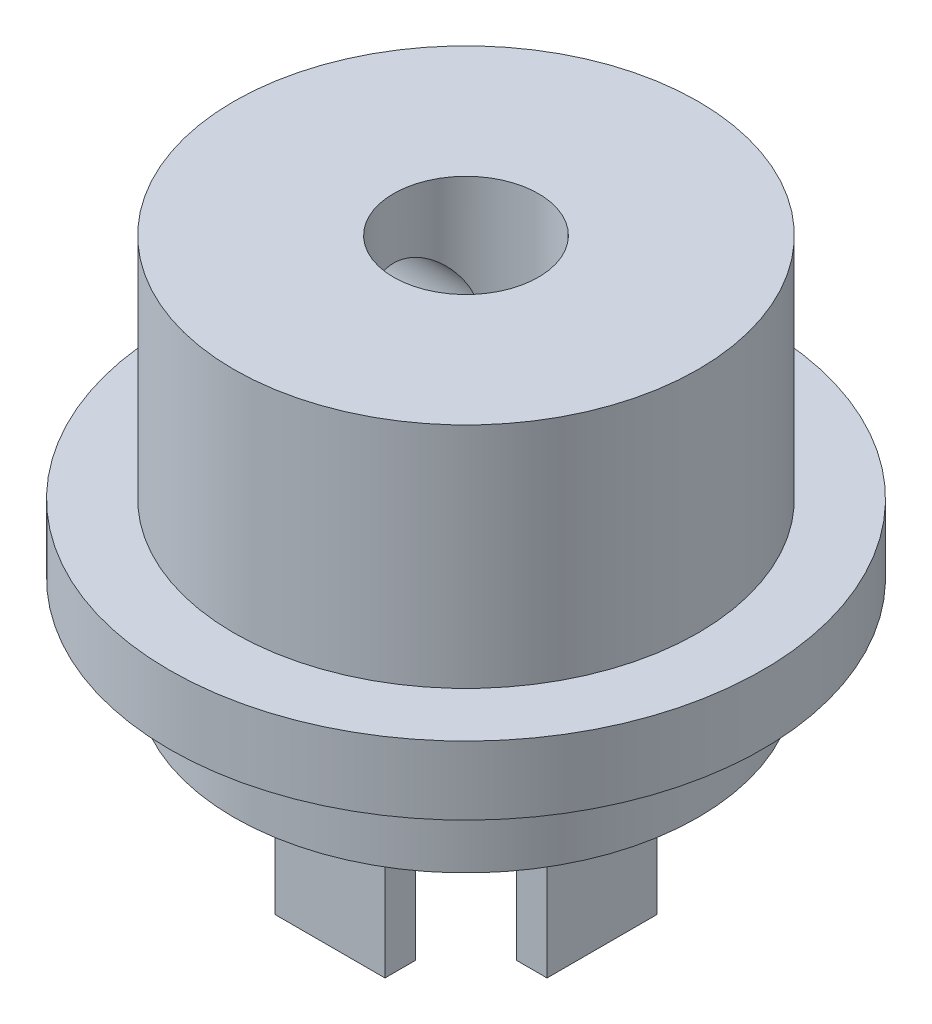
from build123d import *

# Parameters (mm, degrees)
BOSS_EXTRUDE1_DEPTH      = 10
BOSS_EXTRUDE1_DEPTH_BACK = 7
SKETCH1_R                = 10.175
SKETCH1_R_2              = 3.175
SKETCH1_3_R              = 13
SKETCH1_3_R_2            = 10.175
BOSS_EXTRUDE2_DEPTH      = 3
SKETCH2_R                = 2.5
CUT_EXTRUDE1_DEPTH       = 11
SKETCH3_W                = 1.348149628
SKETCH3_H                = 4.814820098
SKETCH3_W_2              = 4.814820098
SKETCH3_H_2              = 1.348149628
BOSS_EXTRUDE3_DEPTH      = 7


with BuildPart() as part:
    # Sketch1 → Boss-Extrude1 (new, two sides: drawn at the far end of the back side and taken through both)
    with BuildSketch(Plane(origin=(0, 0, 0), x_dir=(1, 0, 0), z_dir=(0, 1, 0)).offset(-BOSS_EXTRUDE1_DEPTH_BACK)):
        Circle(SKETCH1_R)
        Circle(SKETCH1_R_2, mode=Mode.SUBTRACT)
    extrude(amount=BOSS_EXTRUDE1_DEPTH + BOSS_EXTRUDE1_DEPTH_BACK)

    # Sketch2 → Cut-Extrude1 (cut)
    with BuildSketch(Plane(origin=(0, 0, 0), x_dir=(0, 0, -1), z_dir=(1, 0, 0))):
        with Locations((0, 4.864105039)):
            Circle(SKETCH2_R)
    extrude(amount=-CUT_EXTRUDE1_DEPTH, mode=Mode.SUBTRACT)

    # Sketch3 → Boss-Extrude3 (add)
    with BuildSketch(Plane.XZ.offset(7)):
        with Locations((5.285239769, 0)):
            Rectangle(SKETCH3_W, SKETCH3_H)
        with Locations((0, 5.285239769)):
            Rectangle(SKETCH3_W_2, SKETCH3_H_2)
        with Locations((0, -5.285239769)):
            Rectangle(SKETCH3_W_2, SKETCH3_H_2)
        with Locations((-5.285239769, 0)):
            Rectangle(SKETCH3_W, SKETCH3_H)
    extrude(amount=BOSS_EXTRUDE3_DEPTH)


with BuildPart() as body_2:
    # Sketch1<3> → Boss-Extrude2 (new body)
    with BuildSketch(Plane(origin=(0, 0, 0), x_dir=(1, 0, 0), z_dir=(0, 1, 0))):
        Circle(SKETCH1_3_R)
        Circle(SKETCH1_3_R_2, mode=Mode.SUBTRACT)
    extrude(amount=-BOSS_EXTRUDE2_DEPTH)


solid = Compound([part.part, body_2.part])
